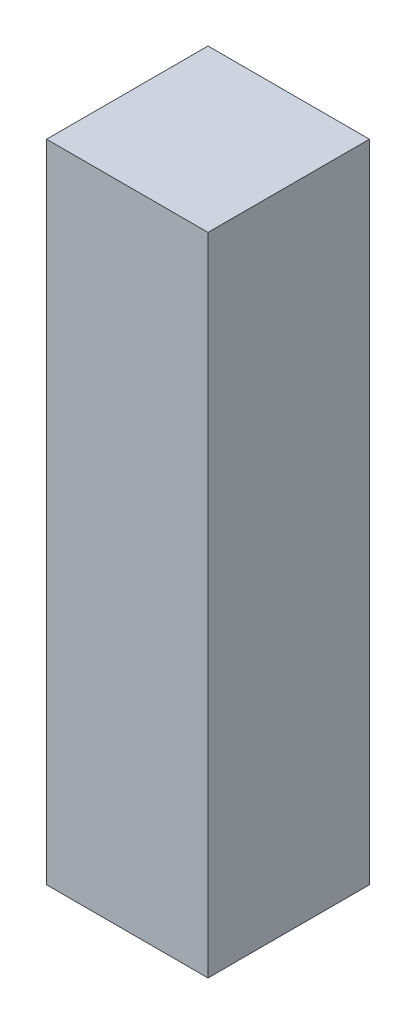
from build123d import *

# Parameters (mm, degrees)
SKETCH1_W           = 38.1
SKETCH1_H           = 38.1
BOSS_EXTRUDE1_DEPTH = 152.4


with BuildPart() as part:
    # Sketch1 → Boss-Extrude1 (new body)
    with BuildSketch(Plane(origin=(0, 0, 0), x_dir=(1, 0, 0), z_dir=(0, 1, 0))):
        Rectangle(SKETCH1_W, SKETCH1_H)
    extrude(amount=BOSS_EXTRUDE1_DEPTH)


solid = part.part
